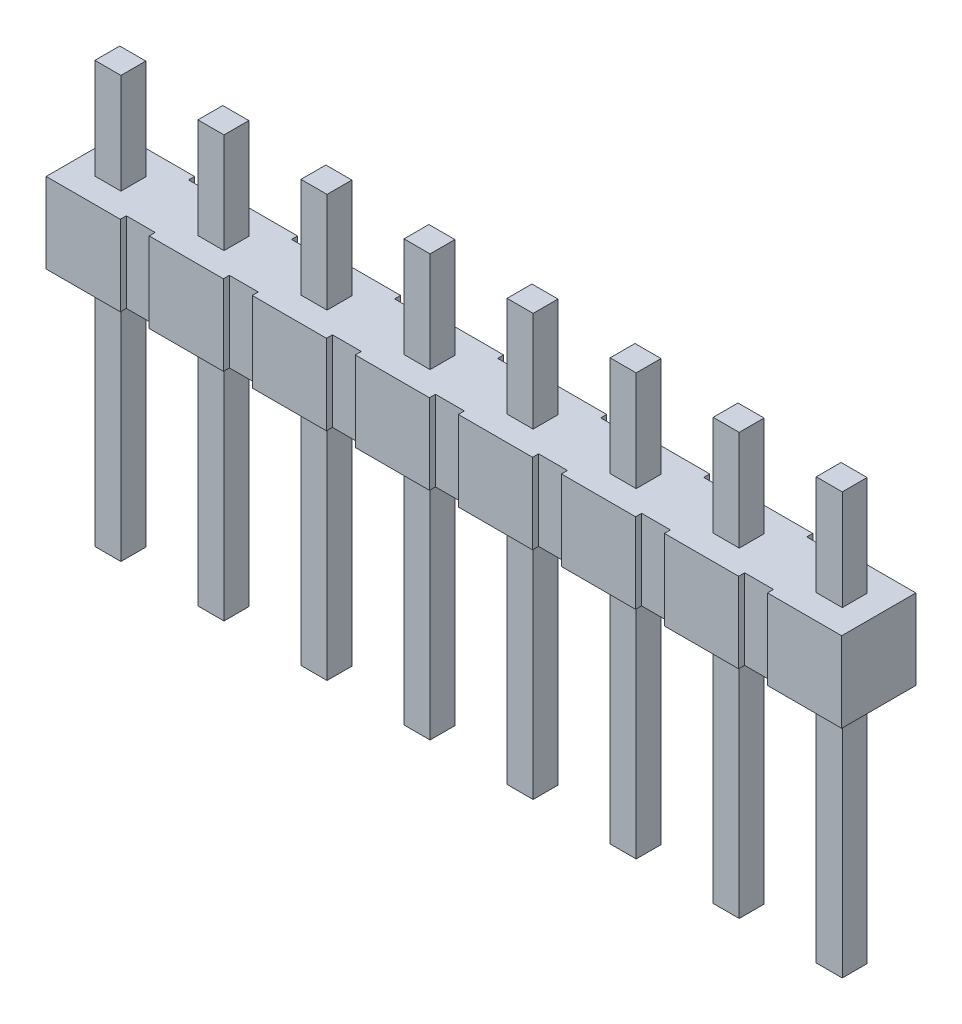
from build123d import *

# Parameters (mm, degrees)
SKETCH1_W                = 0.65
SKETCH1_H                = 0.62
BOSS_EXTRUDE1_DEPTH      = 2
BOSS_EXTRUDE2_DEPTH      = 4.5
BOSS_EXTRUDE2_DEPTH_BACK = 6
SKETCH1_3_W              = 0.65
SKETCH1_3_H              = 0.62


with BuildPart() as part:
    # Sketch1 → Boss-Extrude1 (new body)
    with BuildSketch(Plane(origin=(0, 0, 0), x_dir=(1, 0, 0), z_dir=(0, 1, 0))):
        Polygon((-7.9, 0.925), (-9.75, 0.925), (-9.75, -0.925), (-7.9, -0.925), (-7.9, -0.775), (-7.18, -0.775), (-7.18, -0.925), (-5.33, -0.925), (-5.33, -0.775), (-4.61, -0.775), (-4.61, -0.925), (-2.76, -0.925), (-2.76, -0.775), (-2.04, -0.775), (-2.04, -0.925), (-0.19, -0.925), (-0.19, -0.775), (0.53, -0.775), (0.53, -0.925), (2.38, -0.925), (2.38, -0.775), (3.1, -0.775), (3.1, -0.925), (4.95, -0.925), (4.95, -0.775), (5.67, -0.775), (5.67, -0.925), (7.52, -0.925), (7.52, -0.775), (8.24, -0.775), (8.24, -0.925), (10.09, -0.925), (10.09, 0.925), (8.24, 0.925), (8.24, 0.775), (7.52, 0.775), (7.52, 0.925), (5.67, 0.925), (5.67, 0.775), (4.95, 0.775), (4.95, 0.925), (3.1, 0.925), (3.1, 0.775), (2.38, 0.775), (2.38, 0.925), (0.53, 0.925), (0.53, 0.775), (-0.19, 0.775), (-0.19, 0.925), (-2.04, 0.925), (-2.04, 0.775), (-2.76, 0.775), (-2.76, 0.925), (-4.61, 0.925), (-4.61, 0.775), (-5.33, 0.775), (-5.33, 0.925), (-7.18, 0.925), (-7.18, 0.775), (-7.9, 0.775), align=None)
        with Locations((-8.825, 0)):
            Rectangle(SKETCH1_W, SKETCH1_H, mode=Mode.SUBTRACT)
        with Locations((-6.255, 0)):
            Rectangle(SKETCH1_W, SKETCH1_H, mode=Mode.SUBTRACT)
        with Locations((-3.685, 0)):
            Rectangle(SKETCH1_W, SKETCH1_H, mode=Mode.SUBTRACT)
        with Locations((-1.115, 0)):
            Rectangle(SKETCH1_W, SKETCH1_H, mode=Mode.SUBTRACT)
        with Locations((1.455, 0)):
            Rectangle(SKETCH1_W, SKETCH1_H, mode=Mode.SUBTRACT)
        with Locations((4.025, 0)):
            Rectangle(SKETCH1_W, SKETCH1_H, mode=Mode.SUBTRACT)
        with Locations((6.595, 0)):
            Rectangle(SKETCH1_W, SKETCH1_H, mode=Mode.SUBTRACT)
        with Locations((9.165, 0)):
            Rectangle(SKETCH1_W, SKETCH1_H, mode=Mode.SUBTRACT)
    extrude(amount=BOSS_EXTRUDE1_DEPTH)

    # Sketch1<3> → Boss-Extrude2 (add, two sides: drawn at the far end of the back side and taken through both)
    with BuildSketch(Plane(origin=(0, 0, 0), x_dir=(1, 0, 0), z_dir=(0, 1, 0)).offset(-BOSS_EXTRUDE2_DEPTH_BACK)):
        with Locations((-6.255, 0)):
            Rectangle(SKETCH1_3_W, SKETCH1_3_H)
        with Locations((-8.825, 0)):
            Rectangle(SKETCH1_3_W, SKETCH1_3_H)
        with Locations((-3.685, 0)):
            Rectangle(SKETCH1_3_W, SKETCH1_3_H)
        with Locations((-1.115, 0)):
            Rectangle(SKETCH1_3_W, SKETCH1_3_H)
        with Locations((1.455, 0)):
            Rectangle(SKETCH1_3_W, SKETCH1_3_H)
        with Locations((4.025, 0)):
            Rectangle(SKETCH1_3_W, SKETCH1_3_H)
        with Locations((6.595, 0)):
            Rectangle(SKETCH1_3_W, SKETCH1_3_H)
        with Locations((9.165, 0)):
            Rectangle(SKETCH1_3_W, SKETCH1_3_H)
    extrude(amount=BOSS_EXTRUDE2_DEPTH + BOSS_EXTRUDE2_DEPTH_BACK)


solid = part.part
